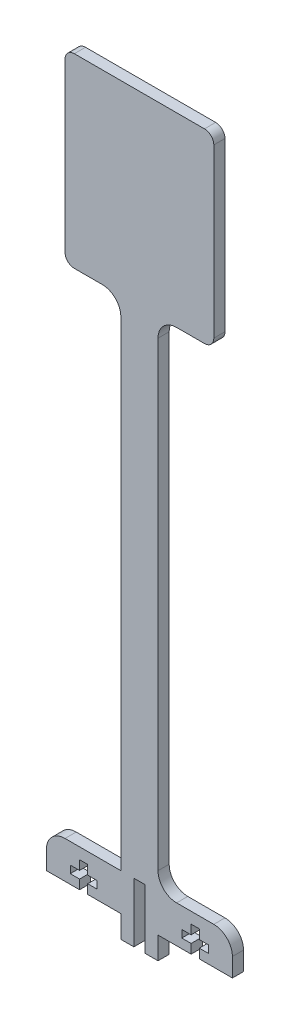
from build123d import *

# Parameters (mm, degrees)
BOSS_EXTRUDE1_DEPTH = 3
FILLET1_R           = 5
FILLET2_R           = 2.5


with BuildPart() as part:
    # Sketch1 → Boss-Extrude1 (new body)
    with BuildSketch(Plane.XY):
        Polygon((-5, -25), (-5, -159), (-25, -159), (-25, -169), (-16.1, -169), (-16.1, -166.5), (-18.6, -166.5), (-18.6, -164.5), (-16.1, -164.5), (-16.1, -162), (-13.9, -162), (-13.9, -164.5), (-11.4, -164.5), (-11.4, -166.5), (-13.9, -166.5), (-13.9, -169), (-5, -169), (-5, -175), (-1.5, -175), (-1.5, -159), (1.5, -159), (1.5, -175), (5, -175), (5, -169), (13.9, -169), (13.9, -166.5), (11.4, -166.5), (11.4, -164.5), (13.9, -164.5), (13.9, -162), (16.1, -162), (16.1, -164.5), (18.6, -164.5), (18.6, -166.5), (16.1, -166.5), (16.1, -169), (25, -169), (25, -159), (5, -159), (5, -25), (20, -25), (20, 25), (0, 25), (-20, 25), (-20, -25), align=None)
    extrude(amount=BOSS_EXTRUDE1_DEPTH)

    # Fillet1
    fillet1_edges = [part.edges().sort_by_distance(p)[0] for p in [
        (5, -25, 1.5),
        (5, -159, 1.5),
        (25, -159, 1.5),
        (-25, -159, 1.5),
        (-5, -25, 1.5),
    ]]
    fillet(fillet1_edges, radius=FILLET1_R)

    # Fillet2
    fillet2_edges = [part.edges().sort_by_distance(p)[0] for p in [
        (-20, -25, 1.5),
        (-20, 25, 1.5),
        (20, 25, 1.5),
        (20, -25, 1.5),
    ]]
    fillet(fillet2_edges, radius=FILLET2_R)


solid = part.part
